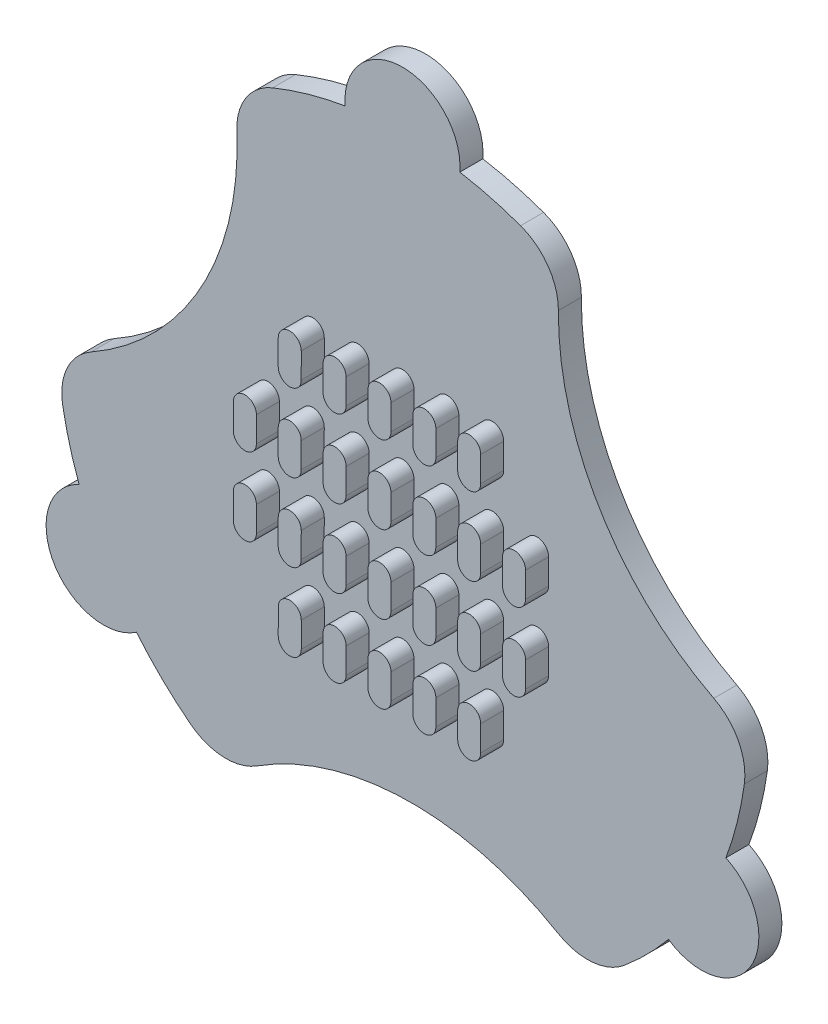
from build123d import *

# Parameters (mm, degrees)
SKETCH2_R           = 18.85
BOSS_EXTRUDE1_DEPTH = 2
SKETCH3_R           = 30
SKETCH3_R_2         = 17.600030795
BOSS_EXTRUDE2_DEPTH = 2
SKETCH6_R           = 5
BOSS_EXTRUDE4_DEPTH = 2
SKETCH7_R           = 25
CUT_EXTRUDE2_DEPTH  = 2
FILLET1_R           = 5
BOSS_EXTRUDE5_DEPTH = 4


with BuildPart() as part:
    # Sketch2 → Boss-Extrude1 (new body)
    with BuildSketch(Plane.XY.offset(10)):
        Circle(SKETCH2_R)
        with BuildLine():
            Line((-6.800910454, 11.232097231), (-6.801789849, 9.032097407))
            ThreePointArc((-6.801789849, 9.032097407), (-7.802189495, 8.032497212), (-8.80178969, 9.032896857))
            Line((-8.80178969, 9.032896857), (-8.800910294, 11.232896682))
            ThreePointArc((-8.800910294, 11.232896682), (-7.800510649, 12.232496877), (-6.800910454, 11.232097231))
        make_face(mode=Mode.SUBTRACT)
        with BuildLine():
            Line((-4.900910294, 11.232896682), (-4.90178969, 9.032896857))
            ThreePointArc((-4.90178969, 9.032896857), (-3.902189495, 8.032497212), (-2.901789849, 9.032097407))
            Line((-2.901789849, 9.032097407), (-2.900910454, 11.232097231))
            ThreePointArc((-2.900910454, 11.232097231), (-3.900510649, 12.232496877), (-4.900910294, 11.232896682))
        make_face(mode=Mode.SUBTRACT)
        with BuildLine():
            Line((-1.000910294, 11.232896682), (-1.00178969, 9.032896857))
            ThreePointArc((-1.00178969, 9.032896857), (-0.002189495, 8.032497212), (0.998210151, 9.032097407))
            Line((0.998210151, 9.032097407), (0.999089546, 11.232097231))
            ThreePointArc((0.999089546, 11.232097231), (-0.000510649, 12.232496877), (-1.000910294, 11.232896682))
        make_face(mode=Mode.SUBTRACT)
        with BuildLine():
            Line((2.899089706, 11.232896682), (2.89821031, 9.032896857))
            ThreePointArc((2.89821031, 9.032896857), (3.897810505, 8.032497212), (4.898210151, 9.032097407))
            Line((4.898210151, 9.032097407), (4.899089546, 11.232097231))
            ThreePointArc((4.899089546, 11.232097231), (3.899489351, 12.232496877), (2.899089706, 11.232896682))
        make_face(mode=Mode.SUBTRACT)
        with BuildLine():
            Line((6.799089706, 11.232896682), (6.79821031, 9.032896857))
            ThreePointArc((6.79821031, 9.032896857), (7.797810505, 8.032497212), (8.798210151, 9.032097407))
            Line((8.798210151, 9.032097407), (8.799089546, 11.232097231))
            ThreePointArc((8.799089546, 11.232097231), (7.799489351, 12.232496877), (6.799089706, 11.232896682))
        make_face(mode=Mode.SUBTRACT)
        with BuildLine():
            Line((-10.703250896, 2.276671291), (-10.701430564, 4.476671291))
            ThreePointArc((-10.701430564, 4.476671291), (-11.700602798, 5.477498373), (-12.701429879, 4.478326138))
            Line((-12.701429879, 4.478326138), (-12.703250212, 2.278326138))
            ThreePointArc((-12.703250212, 2.278326138), (-11.704077977, 1.277499057), (-10.703250896, 2.276671291))
        make_face(mode=Mode.SUBTRACT)
        with BuildLine():
            Line((-8.80360976, 2.278326138), (-8.801789427, 4.478326138))
            ThreePointArc((-8.801789427, 4.478326138), (-7.800962346, 5.477498373), (-6.801790112, 4.476671291))
            Line((-6.801790112, 4.476671291), (-6.803610444, 2.276671291))
            ThreePointArc((-6.803610444, 2.276671291), (-7.804437526, 1.277499057), (-8.80360976, 2.278326138))
        make_face(mode=Mode.SUBTRACT)
        with BuildLine():
            Line((-2.903610444, 2.276671291), (-2.901790112, 4.476671291))
            ThreePointArc((-2.901790112, 4.476671291), (-3.900962346, 5.477498373), (-4.901789427, 4.478326138))
            Line((-4.901789427, 4.478326138), (-4.90360976, 2.278326138))
            ThreePointArc((-4.90360976, 2.278326138), (-3.904437526, 1.277499057), (-2.903610444, 2.276671291))
        make_face(mode=Mode.SUBTRACT)
        with BuildLine():
            Line((0.996389556, 2.276671291), (0.998209888, 4.476671291))
            ThreePointArc((0.998209888, 4.476671291), (-0.000962346, 5.477498373), (-1.001789427, 4.478326138))
            Line((-1.001789427, 4.478326138), (-1.00360976, 2.278326138))
            ThreePointArc((-1.00360976, 2.278326138), (-0.004437526, 1.277499057), (0.996389556, 2.276671291))
        make_face(mode=Mode.SUBTRACT)
        with BuildLine():
            Line((4.896389556, 2.276671291), (4.898209888, 4.476671291))
            ThreePointArc((4.898209888, 4.476671291), (3.899037654, 5.477498373), (2.898210573, 4.478326138))
            Line((2.898210573, 4.478326138), (2.89639024, 2.278326138))
            ThreePointArc((2.89639024, 2.278326138), (3.895562474, 1.277499057), (4.896389556, 2.276671291))
        make_face(mode=Mode.SUBTRACT)
        with BuildLine():
            Line((8.796389556, 2.276671291), (8.798209888, 4.476671291))
            ThreePointArc((8.798209888, 4.476671291), (7.799037654, 5.477498373), (6.798210573, 4.478326138))
            Line((6.798210573, 4.478326138), (6.79639024, 2.278326138))
            ThreePointArc((6.79639024, 2.278326138), (7.795562474, 1.277499057), (8.796389556, 2.276671291))
        make_face(mode=Mode.SUBTRACT)
        with BuildLine():
            Line((12.696389556, 2.276671291), (12.698209888, 4.476671291))
            ThreePointArc((12.698209888, 4.476671291), (11.699037654, 5.477498373), (10.698210573, 4.478326138))
            Line((10.698210573, 4.478326138), (10.69639024, 2.278326138))
            ThreePointArc((10.69639024, 2.278326138), (11.695562474, 1.277499057), (12.696389556, 2.276671291))
        make_face(mode=Mode.SUBTRACT)
        with BuildLine():
            Line((-8.804487832, -4.477431803), (-8.800909394, -2.277431803))
            ThreePointArc((-8.800909394, -2.277431803), (-7.799284156, -1.279059686), (-6.80091204, -2.280684924))
            Line((-6.80091204, -2.280684924), (-6.804490477, -4.480684924))
            ThreePointArc((-6.804490477, -4.480684924), (-7.806115715, -5.47905704), (-8.804487832, -4.477431803))
        make_face(mode=Mode.SUBTRACT)
        with BuildLine():
            Line((-2.904490477, -4.480684924), (-2.90091204, -2.280684924))
            ThreePointArc((-2.90091204, -2.280684924), (-3.899284156, -1.279059686), (-4.900909394, -2.277431803))
            Line((-4.900909394, -2.277431803), (-4.904487832, -4.477431803))
            ThreePointArc((-4.904487832, -4.477431803), (-3.906115715, -5.47905704), (-2.904490477, -4.480684924))
        make_face(mode=Mode.SUBTRACT)
        with BuildLine():
            Line((0.995509523, -4.480684924), (0.99908796, -2.280684924))
            ThreePointArc((0.99908796, -2.280684924), (0.000715844, -1.279059686), (-1.000909394, -2.277431803))
            Line((-1.000909394, -2.277431803), (-1.004487832, -4.477431803))
            ThreePointArc((-1.004487832, -4.477431803), (-0.006115715, -5.47905704), (0.995509523, -4.480684924))
        make_face(mode=Mode.SUBTRACT)
        with BuildLine():
            Line((4.895509523, -4.480684924), (4.89908796, -2.280684924))
            ThreePointArc((4.89908796, -2.280684924), (3.900715844, -1.279059686), (2.899090606, -2.277431803))
            Line((2.899090606, -2.277431803), (2.895512168, -4.477431803))
            ThreePointArc((2.895512168, -4.477431803), (3.893884285, -5.47905704), (4.895509523, -4.480684924))
        make_face(mode=Mode.SUBTRACT)
        with BuildLine():
            Line((8.795509523, -4.480684924), (8.79908796, -2.280684924))
            ThreePointArc((8.79908796, -2.280684924), (7.800715844, -1.279059686), (6.799090606, -2.277431803))
            Line((6.799090606, -2.277431803), (6.795512168, -4.477431803))
            ThreePointArc((6.795512168, -4.477431803), (7.793884285, -5.47905704), (8.795509523, -4.480684924))
        make_face(mode=Mode.SUBTRACT)
        with BuildLine():
            Line((12.695509523, -4.480684924), (12.69908796, -2.280684924))
            ThreePointArc((12.69908796, -2.280684924), (11.700715844, -1.279059686), (10.699090606, -2.277431803))
            Line((10.699090606, -2.277431803), (10.695512168, -4.477431803))
            ThreePointArc((10.695512168, -4.477431803), (11.693884285, -5.47905704), (12.695509523, -4.480684924))
        make_face(mode=Mode.SUBTRACT)
        with BuildLine():
            Line((-10.704130569, -4.480684924), (-10.700552131, -2.280684924))
            ThreePointArc((-10.700552131, -2.280684924), (-11.698924248, -1.279059686), (-12.700549486, -2.277431803))
            Line((-12.700549486, -2.277431803), (-12.704127923, -4.477431803))
            ThreePointArc((-12.704127923, -4.477431803), (-11.705755807, -5.47905704), (-10.704130569, -4.480684924))
        make_face(mode=Mode.SUBTRACT)
        with BuildLine():
            Line((-6.800400323, -9.035846972), (-6.800909294, -11.235846972))
            ThreePointArc((-6.800909294, -11.235846972), (-7.801140618, -12.235615594), (-8.800909241, -11.235384271))
            Line((-8.800909241, -11.235384271), (-8.800400269, -9.035384271))
            ThreePointArc((-8.800400269, -9.035384271), (-7.800168945, -8.035615648), (-6.800400323, -9.035846972))
        make_face(mode=Mode.SUBTRACT)
        with BuildLine():
            Line((-4.900400269, -9.035384271), (-4.900909241, -11.235384271))
            ThreePointArc((-4.900909241, -11.235384271), (-3.901140618, -12.235615594), (-2.900909294, -11.235846972))
            Line((-2.900909294, -11.235846972), (-2.900400323, -9.035846972))
            ThreePointArc((-2.900400323, -9.035846972), (-3.900168945, -8.035615648), (-4.900400269, -9.035384271))
        make_face(mode=Mode.SUBTRACT)
        with BuildLine():
            Line((-1.000400269, -9.035384271), (-1.000909241, -11.235384271))
            ThreePointArc((-1.000909241, -11.235384271), (-0.001140618, -12.235615594), (0.999090706, -11.235846972))
            Line((0.999090706, -11.235846972), (0.999599677, -9.035846972))
            ThreePointArc((0.999599677, -9.035846972), (-0.000168945, -8.035615648), (-1.000400269, -9.035384271))
        make_face(mode=Mode.SUBTRACT)
        with BuildLine():
            Line((2.899599731, -9.035384271), (2.899090759, -11.235384271))
            ThreePointArc((2.899090759, -11.235384271), (3.898859382, -12.235615594), (4.899090706, -11.235846972))
            Line((4.899090706, -11.235846972), (4.899599677, -9.035846972))
            ThreePointArc((4.899599677, -9.035846972), (3.899831055, -8.035615648), (2.899599731, -9.035384271))
        make_face(mode=Mode.SUBTRACT)
        with BuildLine():
            Line((6.799599731, -9.035384271), (6.799090759, -11.235384271))
            ThreePointArc((6.799090759, -11.235384271), (7.798859382, -12.235615594), (8.799090706, -11.235846972))
            Line((8.799090706, -11.235846972), (8.799599677, -9.035846972))
            ThreePointArc((8.799599677, -9.035846972), (7.799831055, -8.035615648), (6.799599731, -9.035384271))
        make_face(mode=Mode.SUBTRACT)
    extrude(amount=BOSS_EXTRUDE1_DEPTH)

    # Sketch3 → Boss-Extrude2 (add)
    with BuildSketch(Plane.XY.offset(12)):
        Circle(SKETCH3_R)
        Circle(SKETCH3_R_2, mode=Mode.SUBTRACT)
    extrude(amount=-BOSS_EXTRUDE2_DEPTH)

    # Sketch6 → Boss-Extrude4 (add)
    with BuildSketch(Plane(origin=(0, 0, 10), x_dir=(-1, 0, 0), z_dir=(0, 0, -1))):
        with Locations((0, 30)):
            Circle(SKETCH6_R)
        with Locations((25.980762114, -15)):
            Circle(SKETCH6_R)
        with Locations((-25.980762114, -15)):
            Circle(SKETCH6_R)
    extrude(amount=-BOSS_EXTRUDE4_DEPTH)

    # Sketch7 → Cut-Extrude2 (cut)
    with BuildSketch(Plane(origin=(0, 0, 10), x_dir=(-1, 0, 0), z_dir=(0, 0, -1))):
        with Locations((-38.550089681, 23.214017006)):
            Circle(SKETCH7_R)
        with Locations((39.378973292, 21.778348479)):
            Circle(SKETCH7_R)
        with Locations((-0.828883611, -44.992365485)):
            Circle(SKETCH7_R)
    extrude(amount=-CUT_EXTRUDE2_DEPTH, mode=Mode.SUBTRACT)

    # Fillet1
    fillet1_edges = [part.edges().sort_by_distance(p)[0] for p in [
        (-14.758617972, 26.118636939, 11),
        (-29.968117125, -1.382734963, 11),
        (-15.240094116, -25.840656558, 11),
        (16.181542167, -25.261783252, 11),
        (29.998712087, -0.277980381, 11),
        (13.786574958, 26.644518215, 11),
    ]]
    fillet(fillet1_edges, radius=FILLET1_R)

    # Sketch2<2> → Boss-Extrude5 (add)
    with BuildSketch(Plane.XY.offset(10)):
        with BuildLine():
            Line((-6.801789849, 9.032097407), (-6.800910454, 11.232097231))
            ThreePointArc((-6.800910454, 11.232097231), (-7.800510649, 12.232496877), (-8.800910294, 11.232896682))
            Line((-8.800910294, 11.232896682), (-8.80178969, 9.032896857))
            ThreePointArc((-8.80178969, 9.032896857), (-7.802189495, 8.032497212), (-6.801789849, 9.032097407))
        make_face()
        with BuildLine():
            ThreePointArc((-2.900910454, 11.232097231), (-3.900510649, 12.232496877), (-4.900910294, 11.232896682))
            Line((-4.900910294, 11.232896682), (-4.90178969, 9.032896857))
            ThreePointArc((-4.90178969, 9.032896857), (-3.902189495, 8.032497212), (-2.901789849, 9.032097407))
            Line((-2.901789849, 9.032097407), (-2.900910454, 11.232097231))
        make_face()
        with BuildLine():
            ThreePointArc((0.999089546, 11.232097231), (-0.000510649, 12.232496877), (-1.000910294, 11.232896682))
            Line((-1.000910294, 11.232896682), (-1.00178969, 9.032896857))
            ThreePointArc((-1.00178969, 9.032896857), (-0.002189495, 8.032497212), (0.998210151, 9.032097407))
            Line((0.998210151, 9.032097407), (0.999089546, 11.232097231))
        make_face()
        with BuildLine():
            ThreePointArc((4.899089546, 11.232097231), (3.899489351, 12.232496877), (2.899089706, 11.232896682))
            Line((2.899089706, 11.232896682), (2.89821031, 9.032896857))
            ThreePointArc((2.89821031, 9.032896857), (3.897810505, 8.032497212), (4.898210151, 9.032097407))
            Line((4.898210151, 9.032097407), (4.899089546, 11.232097231))
        make_face()
        with BuildLine():
            ThreePointArc((8.799089546, 11.232097231), (7.799489351, 12.232496877), (6.799089706, 11.232896682))
            Line((6.799089706, 11.232896682), (6.79821031, 9.032896857))
            ThreePointArc((6.79821031, 9.032896857), (7.797810505, 8.032497212), (8.798210151, 9.032097407))
            Line((8.798210151, 9.032097407), (8.799089546, 11.232097231))
        make_face()
        with BuildLine():
            ThreePointArc((-12.703250212, 2.278326138), (-11.704077977, 1.277499057), (-10.703250896, 2.276671291))
            Line((-10.703250896, 2.276671291), (-10.701430564, 4.476671291))
            ThreePointArc((-10.701430564, 4.476671291), (-11.700602798, 5.477498373), (-12.701429879, 4.478326138))
            Line((-12.701429879, 4.478326138), (-12.703250212, 2.278326138))
        make_face()
        with BuildLine():
            Line((-8.801789427, 4.478326138), (-8.80360976, 2.278326138))
            ThreePointArc((-8.80360976, 2.278326138), (-7.804437526, 1.277499057), (-6.803610444, 2.276671291))
            Line((-6.803610444, 2.276671291), (-6.801790112, 4.476671291))
            ThreePointArc((-6.801790112, 4.476671291), (-7.800962346, 5.477498373), (-8.801789427, 4.478326138))
        make_face()
        with BuildLine():
            ThreePointArc((-4.90360976, 2.278326138), (-3.904437526, 1.277499057), (-2.903610444, 2.276671291))
            Line((-2.903610444, 2.276671291), (-2.901790112, 4.476671291))
            ThreePointArc((-2.901790112, 4.476671291), (-3.900962346, 5.477498373), (-4.901789427, 4.478326138))
            Line((-4.901789427, 4.478326138), (-4.90360976, 2.278326138))
        make_face()
        with BuildLine():
            ThreePointArc((-1.00360976, 2.278326138), (-0.004437526, 1.277499057), (0.996389556, 2.276671291))
            Line((0.996389556, 2.276671291), (0.998209888, 4.476671291))
            ThreePointArc((0.998209888, 4.476671291), (-0.000962346, 5.477498373), (-1.001789427, 4.478326138))
            Line((-1.001789427, 4.478326138), (-1.00360976, 2.278326138))
        make_face()
        with BuildLine():
            ThreePointArc((2.89639024, 2.278326138), (3.895562474, 1.277499057), (4.896389556, 2.276671291))
            Line((4.896389556, 2.276671291), (4.898209888, 4.476671291))
            ThreePointArc((4.898209888, 4.476671291), (3.899037654, 5.477498373), (2.898210573, 4.478326138))
            Line((2.898210573, 4.478326138), (2.89639024, 2.278326138))
        make_face()
        with BuildLine():
            ThreePointArc((6.79639024, 2.278326138), (7.795562474, 1.277499057), (8.796389556, 2.276671291))
            Line((8.796389556, 2.276671291), (8.798209888, 4.476671291))
            ThreePointArc((8.798209888, 4.476671291), (7.799037654, 5.477498373), (6.798210573, 4.478326138))
            Line((6.798210573, 4.478326138), (6.79639024, 2.278326138))
        make_face()
        with BuildLine():
            ThreePointArc((10.69639024, 2.278326138), (11.695562474, 1.277499057), (12.696389556, 2.276671291))
            Line((12.696389556, 2.276671291), (12.698209888, 4.476671291))
            ThreePointArc((12.698209888, 4.476671291), (11.699037654, 5.477498373), (10.698210573, 4.478326138))
            Line((10.698210573, 4.478326138), (10.69639024, 2.278326138))
        make_face()
        with BuildLine():
            Line((-8.800909394, -2.277431803), (-8.804487832, -4.477431803))
            ThreePointArc((-8.804487832, -4.477431803), (-7.806115715, -5.47905704), (-6.804490477, -4.480684924))
            Line((-6.804490477, -4.480684924), (-6.80091204, -2.280684924))
            ThreePointArc((-6.80091204, -2.280684924), (-7.799284156, -1.279059686), (-8.800909394, -2.277431803))
        make_face()
        with BuildLine():
            ThreePointArc((-4.904487832, -4.477431803), (-3.906115715, -5.47905704), (-2.904490477, -4.480684924))
            Line((-2.904490477, -4.480684924), (-2.90091204, -2.280684924))
            ThreePointArc((-2.90091204, -2.280684924), (-3.899284156, -1.279059686), (-4.900909394, -2.277431803))
            Line((-4.900909394, -2.277431803), (-4.904487832, -4.477431803))
        make_face()
        with BuildLine():
            ThreePointArc((-1.004487832, -4.477431803), (-0.006115715, -5.47905704), (0.995509523, -4.480684924))
            Line((0.995509523, -4.480684924), (0.99908796, -2.280684924))
            ThreePointArc((0.99908796, -2.280684924), (0.000715844, -1.279059686), (-1.000909394, -2.277431803))
            Line((-1.000909394, -2.277431803), (-1.004487832, -4.477431803))
        make_face()
        with BuildLine():
            ThreePointArc((2.895512168, -4.477431803), (3.893884285, -5.47905704), (4.895509523, -4.480684924))
            Line((4.895509523, -4.480684924), (4.89908796, -2.280684924))
            ThreePointArc((4.89908796, -2.280684924), (3.900715844, -1.279059686), (2.899090606, -2.277431803))
            Line((2.899090606, -2.277431803), (2.895512168, -4.477431803))
        make_face()
        with BuildLine():
            ThreePointArc((6.795512168, -4.477431803), (7.793884285, -5.47905704), (8.795509523, -4.480684924))
            Line((8.795509523, -4.480684924), (8.79908796, -2.280684924))
            ThreePointArc((8.79908796, -2.280684924), (7.800715844, -1.279059686), (6.799090606, -2.277431803))
            Line((6.799090606, -2.277431803), (6.795512168, -4.477431803))
        make_face()
        with BuildLine():
            ThreePointArc((10.695512168, -4.477431803), (11.693884285, -5.47905704), (12.695509523, -4.480684924))
            Line((12.695509523, -4.480684924), (12.69908796, -2.280684924))
            ThreePointArc((12.69908796, -2.280684924), (11.700715844, -1.279059686), (10.699090606, -2.277431803))
            Line((10.699090606, -2.277431803), (10.695512168, -4.477431803))
        make_face()
        with BuildLine():
            ThreePointArc((-12.704127923, -4.477431803), (-11.705755807, -5.47905704), (-10.704130569, -4.480684924))
            Line((-10.704130569, -4.480684924), (-10.700552131, -2.280684924))
            ThreePointArc((-10.700552131, -2.280684924), (-11.698924248, -1.279059686), (-12.700549486, -2.277431803))
            Line((-12.700549486, -2.277431803), (-12.704127923, -4.477431803))
        make_face()
        with BuildLine():
            Line((-6.800909294, -11.235846972), (-6.800400323, -9.035846972))
            ThreePointArc((-6.800400323, -9.035846972), (-7.800168945, -8.035615648), (-8.800400269, -9.035384271))
            Line((-8.800400269, -9.035384271), (-8.800909241, -11.235384271))
            ThreePointArc((-8.800909241, -11.235384271), (-7.801140618, -12.235615594), (-6.800909294, -11.235846972))
        make_face()
        with BuildLine():
            ThreePointArc((-2.900400323, -9.035846972), (-3.900168945, -8.035615648), (-4.900400269, -9.035384271))
            Line((-4.900400269, -9.035384271), (-4.900909241, -11.235384271))
            ThreePointArc((-4.900909241, -11.235384271), (-3.901140618, -12.235615594), (-2.900909294, -11.235846972))
            Line((-2.900909294, -11.235846972), (-2.900400323, -9.035846972))
        make_face()
        with BuildLine():
            ThreePointArc((0.999599677, -9.035846972), (-0.000168945, -8.035615648), (-1.000400269, -9.035384271))
            Line((-1.000400269, -9.035384271), (-1.000909241, -11.235384271))
            ThreePointArc((-1.000909241, -11.235384271), (-0.001140618, -12.235615594), (0.999090706, -11.235846972))
            Line((0.999090706, -11.235846972), (0.999599677, -9.035846972))
        make_face()
        with BuildLine():
            ThreePointArc((4.899599677, -9.035846972), (3.899831055, -8.035615648), (2.899599731, -9.035384271))
            Line((2.899599731, -9.035384271), (2.899090759, -11.235384271))
            ThreePointArc((2.899090759, -11.235384271), (3.898859382, -12.235615594), (4.899090706, -11.235846972))
            Line((4.899090706, -11.235846972), (4.899599677, -9.035846972))
        make_face()
        with BuildLine():
            ThreePointArc((8.799599677, -9.035846972), (7.799831055, -8.035615648), (6.799599731, -9.035384271))
            Line((6.799599731, -9.035384271), (6.799090759, -11.235384271))
            ThreePointArc((6.799090759, -11.235384271), (7.798859382, -12.235615594), (8.799090706, -11.235846972))
            Line((8.799090706, -11.235846972), (8.799599677, -9.035846972))
        make_face()
    extrude(amount=BOSS_EXTRUDE5_DEPTH)


solid = part.part
